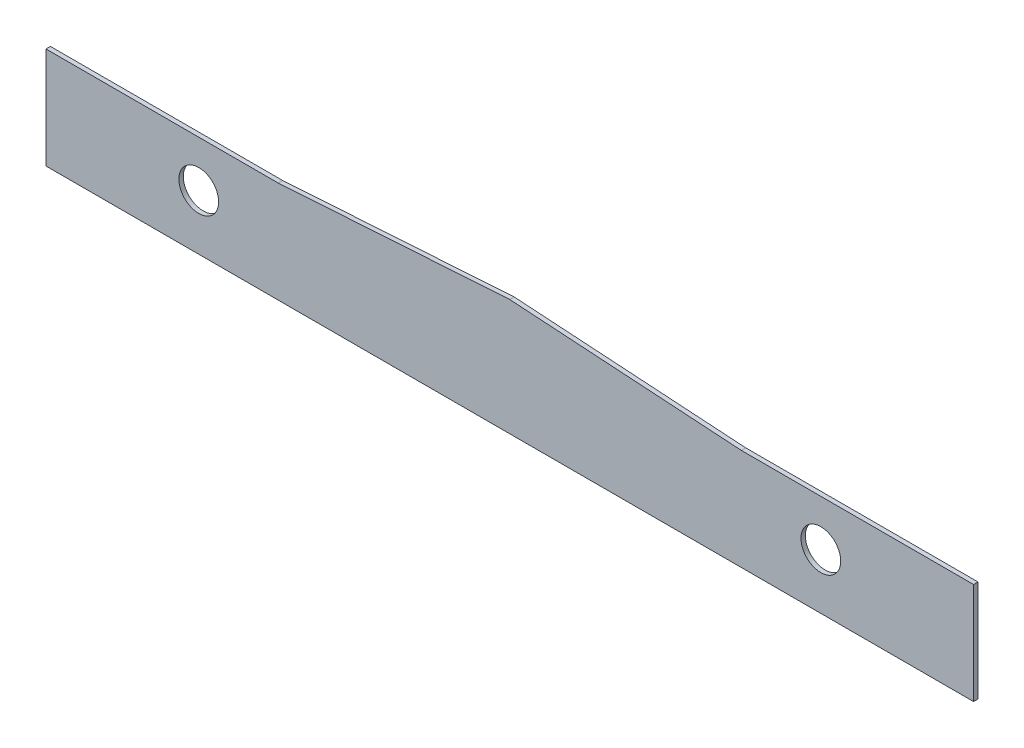
from build123d import *

# Parameters (mm, degrees)
SCHIZZO1_W                   = 420
SCHIZZO1_H                   = 45.92
PIASTRABASE_DEPTH            = 2
SCHIZZO2_R                   = 9
FOROTUBOMOTORE_DEPTH         = 212.260885163
ESTRUSIONE_ESTRUSIONE1_DEPTH = 2


with BuildPart() as part:
    # Schizzo1 → PiastraBase (new body)
    with BuildSketch(Plane.XY):
        Rectangle(SCHIZZO1_W, SCHIZZO1_H)
    extrude(amount=PIASTRABASE_DEPTH)

    # Schizzo2 → ForoTuboMotore (cut, through all)
    with BuildSketch(Plane.XY.offset(2)):
        with Locations((-140.833333333, 2.04)):
            Circle(SCHIZZO2_R)
    forotubomotore = extrude(amount=-FOROTUBOMOTORE_DEPTH, mode=Mode.SUBTRACT)

    # Specchia1: ForoTuboMotore across plane
    add(forotubomotore.mirror(Plane(origin=(0, 0, 0), x_dir=(0, 0, 1), z_dir=(1, 0, 0))), mode=Mode.SUBTRACT)

    # Schizzo4 → Estrusione-Estrusione1 (add)
    with BuildSketch(Plane.XY.offset(2)):
        Polygon((104.844657179, 22.96), (0, 29.70924382), (0, 22.96), align=None)
    estrusione_estrusione1 = extrude(amount=-ESTRUSIONE_ESTRUSIONE1_DEPTH)

    # Specchia2: Estrusione-Estrusione1 across plane
    add(estrusione_estrusione1.mirror(Plane(origin=(0, 0, 0), x_dir=(0, 0, 1), z_dir=(1, 0, 0))))


solid = part.part
